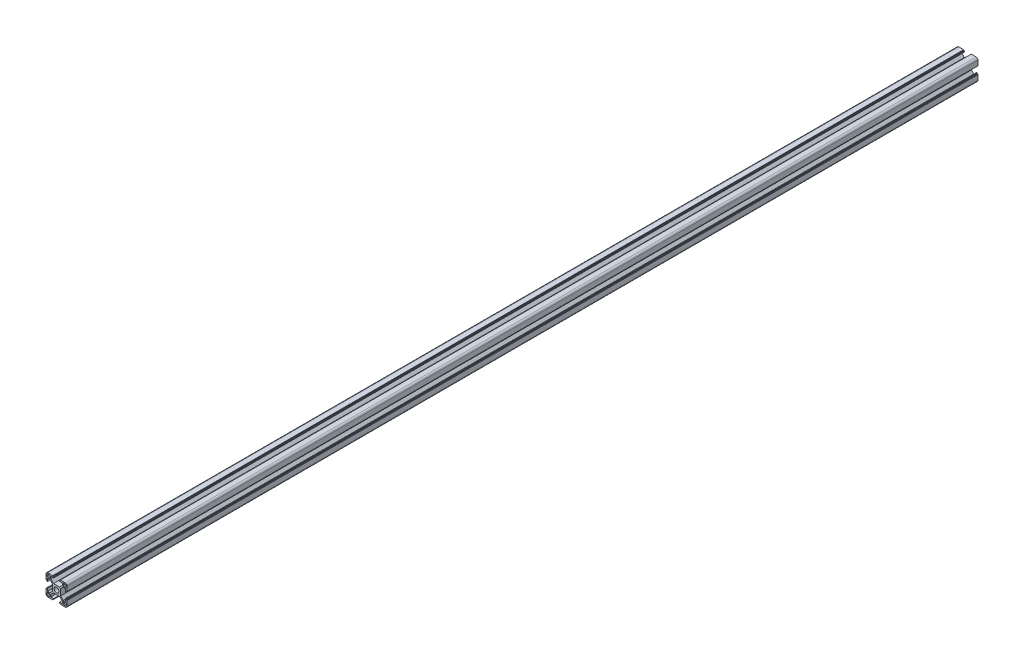
from build123d import *

# Parameters (mm, degrees)
BOSS_EXTRUDE1_DEPTH = 250
SKETCH2_R           = 3.4
CUT_EXTRUDE1_DEPTH  = 251.898385806
FILLET1_R           = 2.5
FILLET2_R           = 0.25
SKETCH3_R           = 3.4
BOSS_EXTRUDE2_DEPTH = 1050


with BuildPart() as part:
    # Sketch1 → Boss-Extrude1 (new body)
    with BuildSketch(Plane.XY):
        Polygon((-15, 15), (-5.2, 15), (-5.2, 13.808325472), (-4.1, 13.808325472), (-4.1, 12.8), (-8.25, 12.8), (-8.25, 9.664213562), (-4.385786438, 5.8), (4.385786438, 5.8), (8.25, 9.664213562), (8.25, 12.8), (4.1, 12.8), (4.1, 13.808325472), (5.2, 13.808325472), (5.2, 15), (15, 15), (15, 5.2), (13.808325472, 5.2), (13.808325472, 4.1), (12.8, 4.1), (12.8, 8.25), (9.664213562, 8.25), (5.8, 4.385786438), (5.8, -4.385786438), (9.664213562, -8.25), (12.8, -8.25), (12.8, -4.1), (13.808325472, -4.1), (13.808325472, -5.2), (15, -5.2), (15, -15), (5.2, -15), (5.2, -13.808325472), (4.1, -13.808325472), (4.1, -12.8), (8.25, -12.8), (8.25, -9.664213562), (4.385786438, -5.8), (-4.385786438, -5.8), (-8.25, -9.664213562), (-8.25, -12.8), (-4.1, -12.8), (-4.1, -13.808325472), (-5.2, -13.808325472), (-5.2, -15), (-15, -15), (-15, -5.2), (-13.808325472, -5.2), (-13.808325472, -4.1), (-12.8, -4.1), (-12.8, -8.25), (-9.664213562, -8.25), (-5.8, -4.385786438), (-5.8, 4.385786438), (-9.664213562, 8.25), (-12.8, 8.25), (-12.8, 4.1), (-13.808325472, 4.1), (-13.808325472, 5.2), (-15, 5.2), align=None)
    extrude(amount=BOSS_EXTRUDE1_DEPTH)

    # Sketch2 → Cut-Extrude1 (cut, through all)
    with BuildSketch(Plane.XY.offset(250)):
        Circle(SKETCH2_R)
        with BuildLine():
            Line((-12.5, 13.5), (-10.5, 13.5))
            ThreePointArc((-10.5, 13.5), (-9.792893219, 13.207106781), (-9.5, 12.5))
            Line((-9.5, 12.5), (-9.5, 10.5))
            ThreePointArc((-9.5, 10.5), (-9.792893219, 9.792893219), (-10.5, 9.5))
            Line((-10.5, 9.5), (-12.5, 9.5))
            ThreePointArc((-12.5, 9.5), (-13.207106781, 9.792893219), (-13.5, 10.5))
            Line((-13.5, 10.5), (-13.5, 12.5))
            ThreePointArc((-13.5, 12.5), (-13.207106781, 13.207106781), (-12.5, 13.5))
        make_face()
        with BuildLine():
            Line((9.5, 12.5), (9.5, 10.5))
            ThreePointArc((9.5, 10.5), (9.792893219, 9.792893219), (10.5, 9.5))
            Line((10.5, 9.5), (12.5, 9.5))
            ThreePointArc((12.5, 9.5), (13.207106781, 9.792893219), (13.5, 10.5))
            Line((13.5, 10.5), (13.5, 12.5))
            ThreePointArc((13.5, 12.5), (13.207106781, 13.207106781), (12.5, 13.5))
            Line((12.5, 13.5), (10.5, 13.5))
            ThreePointArc((10.5, 13.5), (9.792893219, 13.207106781), (9.5, 12.5))
        make_face()
        with BuildLine():
            Line((12.5, -13.5), (10.5, -13.5))
            ThreePointArc((10.5, -13.5), (9.792893219, -13.207106781), (9.5, -12.5))
            Line((9.5, -12.5), (9.5, -10.5))
            ThreePointArc((9.5, -10.5), (9.792893219, -9.792893219), (10.5, -9.5))
            Line((10.5, -9.5), (12.5, -9.5))
            ThreePointArc((12.5, -9.5), (13.207106781, -9.792893219), (13.5, -10.5))
            Line((13.5, -10.5), (13.5, -12.5))
            ThreePointArc((13.5, -12.5), (13.207106781, -13.207106781), (12.5, -13.5))
        make_face()
        with BuildLine():
            Line((-9.5, -12.5), (-9.5, -10.5))
            ThreePointArc((-9.5, -10.5), (-9.792893219, -9.792893219), (-10.5, -9.5))
            Line((-10.5, -9.5), (-12.5, -9.5))
            ThreePointArc((-12.5, -9.5), (-13.207106781, -9.792893219), (-13.5, -10.5))
            Line((-13.5, -10.5), (-13.5, -12.5))
            ThreePointArc((-13.5, -12.5), (-13.207106781, -13.207106781), (-12.5, -13.5))
            Line((-12.5, -13.5), (-10.5, -13.5))
            ThreePointArc((-10.5, -13.5), (-9.792893219, -13.207106781), (-9.5, -12.5))
        make_face()
    extrude(amount=-CUT_EXTRUDE1_DEPTH, mode=Mode.SUBTRACT)

    # Fillet1
    fillet1_edges = [part.edges().sort_by_distance(p)[0] for p in [
        (15, -15, 125),
        (-15, -15, 125),
        (-15, 15, 125),
        (15, 15, 125),
    ]]
    fillet(fillet1_edges, radius=FILLET1_R)

    # Fillet2
    fillet2_edges = [part.edges().sort_by_distance(p)[0] for p in [
        (5.2, -15, 125),
        (5.2, -13.808325472, 125),
        (4.1, -13.808325472, 125),
        (-4.1, -13.808325472, 125),
        (-5.2, -13.808325472, 125),
        (-5.2, -15, 125),
        (-15, -5.2, 125),
        (-13.808325472, -5.2, 125),
        (-13.808325472, -4.1, 125),
        (-13.808325472, 4.1, 125),
        (-13.808325472, 5.2, 125),
        (-15, 5.2, 125),
        (-5.2, 15, 125),
        (-5.2, 13.808325472, 125),
        (-4.1, 13.808325472, 125),
        (4.1, 13.808325472, 125),
        (5.2, 13.808325472, 125),
        (5.2, 15, 125),
        (15, 5.2, 125),
        (13.808325472, 5.2, 125),
        (13.808325472, 4.1, 125),
        (13.808325472, -4.1, 125),
        (13.808325472, -5.2, 125),
        (15, -5.2, 125),
    ]]
    fillet(fillet2_edges, radius=FILLET2_R)

    # Sketch3 → Boss-Extrude2 (add)
    with BuildSketch(Plane(origin=(0, 0, 0), x_dir=(-1, 0, 0), z_dir=(0, 0, -1))):
        with BuildLine():
            Line((12.8, 4.1), (13.558325472, 4.1))
            ThreePointArc((13.558325472, 4.1), (13.735102167, 4.173223305), (13.808325472, 4.35))
            Line((13.808325472, 4.35), (13.808325472, 4.95))
            ThreePointArc((13.808325472, 4.95), (13.881548777, 5.126776695), (14.058325472, 5.2))
            Line((14.058325472, 5.2), (14.75, 5.2))
            ThreePointArc((14.75, 5.2), (14.926776695, 5.273223305), (15, 5.45))
            Line((15, 5.45), (15, 12.5))
            ThreePointArc((15, 12.5), (14.267766953, 14.267766953), (12.5, 15))
            Line((12.5, 15), (5.45, 15))
            ThreePointArc((5.45, 15), (5.273223305, 14.926776695), (5.2, 14.75))
            Line((5.2, 14.75), (5.2, 14.058325472))
            ThreePointArc((5.2, 14.058325472), (5.126776695, 13.881548777), (4.95, 13.808325472))
            Line((4.95, 13.808325472), (4.35, 13.808325472))
            ThreePointArc((4.35, 13.808325472), (4.173223305, 13.735102167), (4.1, 13.558325472))
            Line((4.1, 13.558325472), (4.1, 12.8))
            Line((4.1, 12.8), (8.25, 12.8))
            Line((8.25, 12.8), (8.25, 9.664213562))
            Line((8.25, 9.664213562), (4.385786438, 5.8))
            Line((4.385786438, 5.8), (-4.385786438, 5.8))
            Line((-4.385786438, 5.8), (-8.25, 9.664213562))
            Line((-8.25, 9.664213562), (-8.25, 12.8))
            Line((-8.25, 12.8), (-4.1, 12.8))
            Line((-4.1, 12.8), (-4.1, 13.558325472))
            ThreePointArc((-4.1, 13.558325472), (-4.173223305, 13.735102167), (-4.35, 13.808325472))
            Line((-4.35, 13.808325472), (-4.95, 13.808325472))
            ThreePointArc((-4.95, 13.808325472), (-5.126776695, 13.881548777), (-5.2, 14.058325472))
            Line((-5.2, 14.058325472), (-5.2, 14.75))
            ThreePointArc((-5.2, 14.75), (-5.273223305, 14.926776695), (-5.45, 15))
            Line((-5.45, 15), (-12.5, 15))
            ThreePointArc((-12.5, 15), (-14.267766953, 14.267766953), (-15, 12.5))
            Line((-15, 12.5), (-15, 5.45))
            ThreePointArc((-15, 5.45), (-14.926776695, 5.273223305), (-14.75, 5.2))
            Line((-14.75, 5.2), (-14.058325472, 5.2))
            ThreePointArc((-14.058325472, 5.2), (-13.881548777, 5.126776695), (-13.808325472, 4.95))
            Line((-13.808325472, 4.95), (-13.808325472, 4.35))
            ThreePointArc((-13.808325472, 4.35), (-13.735102167, 4.173223305), (-13.558325472, 4.1))
            Line((-13.558325472, 4.1), (-12.8, 4.1))
            Line((-12.8, 4.1), (-12.8, 8.25))
            Line((-12.8, 8.25), (-9.664213562, 8.25))
            Line((-9.664213562, 8.25), (-5.8, 4.385786438))
            Line((-5.8, 4.385786438), (-5.8, -4.385786438))
            Line((-5.8, -4.385786438), (-9.664213562, -8.25))
            Line((-9.664213562, -8.25), (-12.8, -8.25))
            Line((-12.8, -8.25), (-12.8, -4.1))
            Line((-12.8, -4.1), (-13.558325472, -4.1))
            ThreePointArc((-13.558325472, -4.1), (-13.735102167, -4.173223305), (-13.808325472, -4.35))
            Line((-13.808325472, -4.35), (-13.808325472, -4.95))
            ThreePointArc((-13.808325472, -4.95), (-13.881548777, -5.126776695), (-14.058325472, -5.2))
            Line((-14.058325472, -5.2), (-14.75, -5.2))
            ThreePointArc((-14.75, -5.2), (-14.926776695, -5.273223305), (-15, -5.45))
            Line((-15, -5.45), (-15, -12.5))
            ThreePointArc((-15, -12.5), (-14.267766953, -14.267766953), (-12.5, -15))
            Line((-12.5, -15), (-5.45, -15))
            ThreePointArc((-5.45, -15), (-5.273223305, -14.926776695), (-5.2, -14.75))
            Line((-5.2, -14.75), (-5.2, -14.058325472))
            ThreePointArc((-5.2, -14.058325472), (-5.126776695, -13.881548777), (-4.95, -13.808325472))
            Line((-4.95, -13.808325472), (-4.35, -13.808325472))
            ThreePointArc((-4.35, -13.808325472), (-4.173223305, -13.735102167), (-4.1, -13.558325472))
            Line((-4.1, -13.558325472), (-4.1, -12.8))
            Line((-4.1, -12.8), (-8.25, -12.8))
            Line((-8.25, -12.8), (-8.25, -9.664213562))
            Line((-8.25, -9.664213562), (-4.385786438, -5.8))
            Line((-4.385786438, -5.8), (4.385786438, -5.8))
            Line((4.385786438, -5.8), (8.25, -9.664213562))
            Line((8.25, -9.664213562), (8.25, -12.8))
            Line((8.25, -12.8), (4.1, -12.8))
            Line((4.1, -12.8), (4.1, -13.558325472))
            ThreePointArc((4.1, -13.558325472), (4.173223305, -13.735102167), (4.35, -13.808325472))
            Line((4.35, -13.808325472), (4.95, -13.808325472))
            ThreePointArc((4.95, -13.808325472), (5.126776695, -13.881548777), (5.2, -14.058325472))
            Line((5.2, -14.058325472), (5.2, -14.75))
            ThreePointArc((5.2, -14.75), (5.273223305, -14.926776695), (5.45, -15))
            Line((5.45, -15), (12.5, -15))
            ThreePointArc((12.5, -15), (14.267766953, -14.267766953), (15, -12.5))
            Line((15, -12.5), (15, -5.45))
            ThreePointArc((15, -5.45), (14.926776695, -5.273223305), (14.75, -5.2))
            Line((14.75, -5.2), (14.058325472, -5.2))
            ThreePointArc((14.058325472, -5.2), (13.881548777, -5.126776695), (13.808325472, -4.95))
            Line((13.808325472, -4.95), (13.808325472, -4.35))
            ThreePointArc((13.808325472, -4.35), (13.735102167, -4.173223305), (13.558325472, -4.1))
            Line((13.558325472, -4.1), (12.8, -4.1))
            Line((12.8, -4.1), (12.8, -8.25))
            Line((12.8, -8.25), (9.664213562, -8.25))
            Line((9.664213562, -8.25), (5.8, -4.385786438))
            Line((5.8, -4.385786438), (5.8, 4.385786438))
            Line((5.8, 4.385786438), (9.664213562, 8.25))
            Line((9.664213562, 8.25), (12.8, 8.25))
            Line((12.8, 8.25), (12.8, 4.1))
        make_face()
        with Locations(Location((0, 0, 0), (0, 0, 180))):
            Circle(SKETCH3_R, mode=Mode.SUBTRACT)
        with BuildLine():
            Line((-9.5, 12.5), (-9.5, 10.5))
            ThreePointArc((-9.5, 10.5), (-9.792893219, 9.792893219), (-10.5, 9.5))
            Line((-10.5, 9.5), (-12.5, 9.5))
            ThreePointArc((-12.5, 9.5), (-13.207106781, 9.792893219), (-13.5, 10.5))
            Line((-13.5, 10.5), (-13.5, 12.5))
            ThreePointArc((-13.5, 12.5), (-13.207106781, 13.207106781), (-12.5, 13.5))
            Line((-12.5, 13.5), (-10.5, 13.5))
            ThreePointArc((-10.5, 13.5), (-9.792893219, 13.207106781), (-9.5, 12.5))
        make_face(mode=Mode.SUBTRACT)
        with BuildLine():
            Line((12.5, 9.5), (10.5, 9.5))
            ThreePointArc((10.5, 9.5), (9.792893219, 9.792893219), (9.5, 10.5))
            Line((9.5, 10.5), (9.5, 12.5))
            ThreePointArc((9.5, 12.5), (9.792893219, 13.207106781), (10.5, 13.5))
            Line((10.5, 13.5), (12.5, 13.5))
            ThreePointArc((12.5, 13.5), (13.207106781, 13.207106781), (13.5, 12.5))
            Line((13.5, 12.5), (13.5, 10.5))
            ThreePointArc((13.5, 10.5), (13.207106781, 9.792893219), (12.5, 9.5))
        make_face(mode=Mode.SUBTRACT)
        with BuildLine():
            Line((9.5, -12.5), (9.5, -10.5))
            ThreePointArc((9.5, -10.5), (9.792893219, -9.792893219), (10.5, -9.5))
            Line((10.5, -9.5), (12.5, -9.5))
            ThreePointArc((12.5, -9.5), (13.207106781, -9.792893219), (13.5, -10.5))
            Line((13.5, -10.5), (13.5, -12.5))
            ThreePointArc((13.5, -12.5), (13.207106781, -13.207106781), (12.5, -13.5))
            Line((12.5, -13.5), (10.5, -13.5))
            ThreePointArc((10.5, -13.5), (9.792893219, -13.207106781), (9.5, -12.5))
        make_face(mode=Mode.SUBTRACT)
        with BuildLine():
            Line((-9.5, -10.5), (-9.5, -12.5))
            ThreePointArc((-9.5, -12.5), (-9.792893219, -13.207106781), (-10.5, -13.5))
            Line((-10.5, -13.5), (-12.5, -13.5))
            ThreePointArc((-12.5, -13.5), (-13.207106781, -13.207106781), (-13.5, -12.5))
            Line((-13.5, -12.5), (-13.5, -10.5))
            ThreePointArc((-13.5, -10.5), (-13.207106781, -9.792893219), (-12.5, -9.5))
            Line((-12.5, -9.5), (-10.5, -9.5))
            ThreePointArc((-10.5, -9.5), (-9.792893219, -9.792893219), (-9.5, -10.5))
        make_face(mode=Mode.SUBTRACT)
    extrude(amount=BOSS_EXTRUDE2_DEPTH)


solid = part.part
